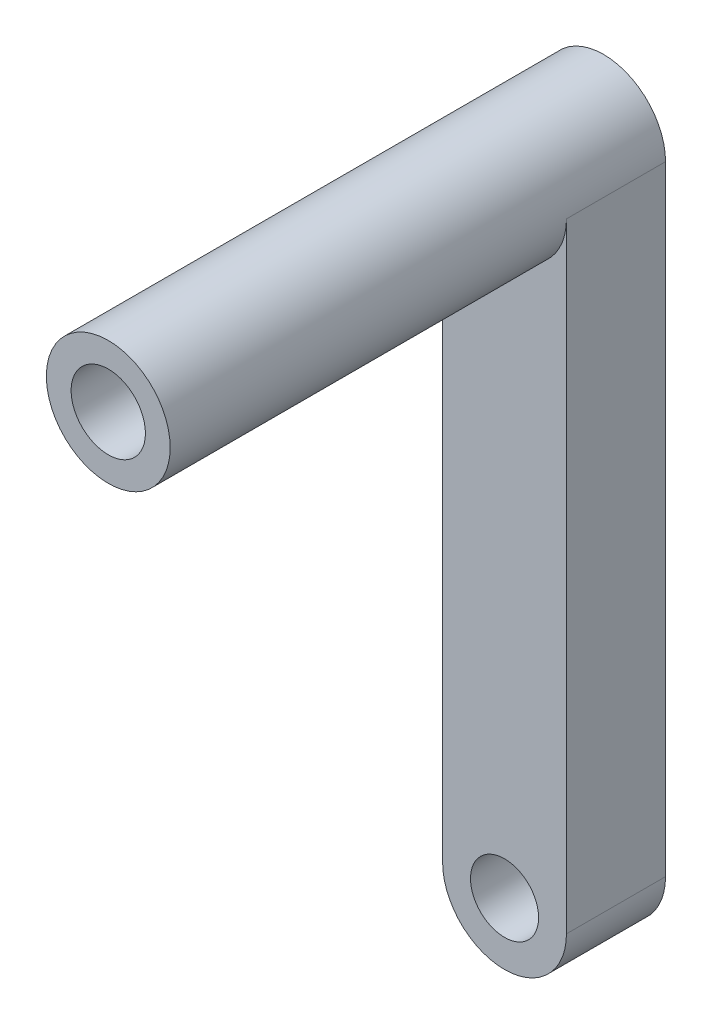
from build123d import *

# Parameters (mm, degrees)
SKETCH1_R           = 1.375
BOSS_EXTRUDE3_DEPTH = 4
SKETCH1_6_R         = 1.5
BOSS_EXTRUDE4_DEPTH = 20


with BuildPart() as part:
    # Sketch1 → Boss-Extrude3 (new body)
    with BuildSketch(Plane.XY):
        with BuildLine():
            Line((-2.5, 14.852941176), (-2.5, -10.147058824))
            ThreePointArc((-2.5, -10.147058824), (0, -12.647058824), (2.5, -10.147058824))
            Line((2.5, -10.147058824), (2.5, 14.852941176))
            ThreePointArc((2.5, 14.852941176), (0, 12.352941176), (-2.5, 14.852941176))
        make_face()
        with Locations((0, -10.147058824)):
            Circle(SKETCH1_R, mode=Mode.SUBTRACT)
    extrude(amount=BOSS_EXTRUDE3_DEPTH)

    # Sketch1<6> → Boss-Extrude4 (add)
    with BuildSketch(Plane.XY):
        with BuildLine():
            ThreePointArc((2.5, 14.852941176), (0, 17.352941176), (-2.5, 14.852941176))
            ThreePointArc((-2.5, 14.852941176), (0, 12.352941176), (2.5, 14.852941176))
        make_face()
        with Locations((0, 14.852941176)):
            Circle(SKETCH1_6_R, mode=Mode.SUBTRACT)
    extrude(amount=BOSS_EXTRUDE4_DEPTH)


solid = part.part
